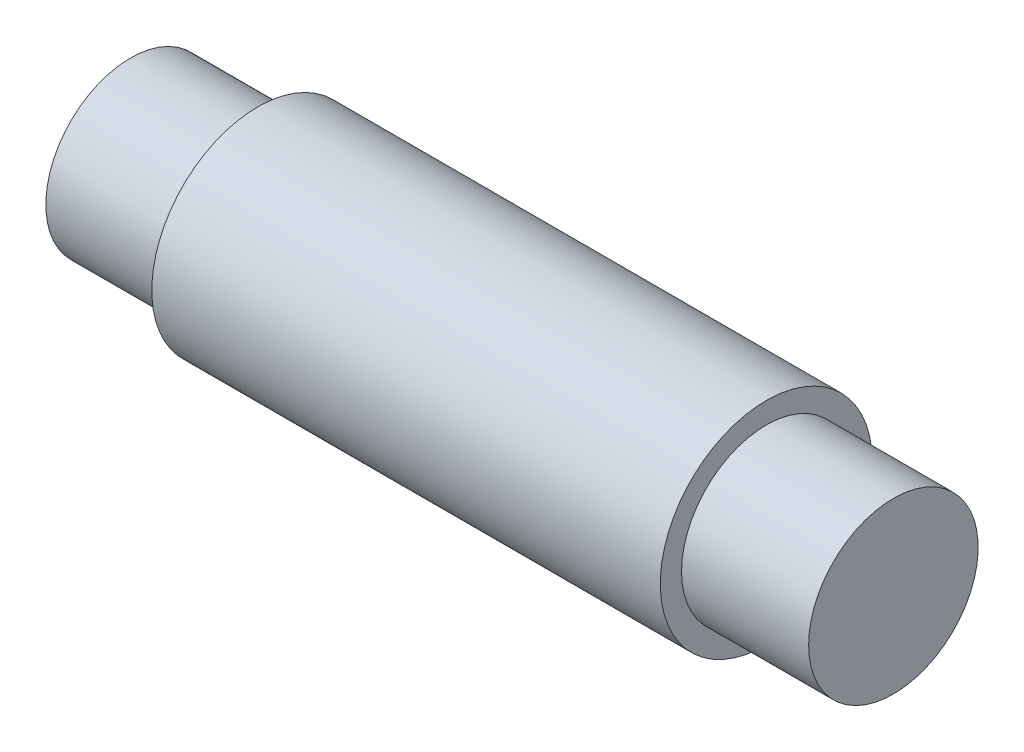
from build123d import *

# Parameters (mm, degrees)
SKETCH2_R           = 3.175
BOSS_EXTRUDE1_DEPTH = 2.38125
SKETCH3_R           = 3.96875
BOSS_EXTRUDE2_DEPTH = 19.05
SKETCH5_R           = 3.175
BOSS_EXTRUDE3_DEPTH = 4.7625


with BuildPart() as part:
    # Sketch2 → Boss-Extrude1 (new, symmetric)
    with BuildSketch(Plane(origin=(0, 0, 0), x_dir=(0, 0, -1), z_dir=(1, 0, 0))):
        with Locations(Location((0, 0, 0), (0, 0, 180))):
            Circle(SKETCH2_R)
    extrude(amount=BOSS_EXTRUDE1_DEPTH, both=True)

    # Sketch3 → Boss-Extrude2 (add)
    with BuildSketch(Plane.ZY.offset(2.38125)):
        with Locations(Location((0, 0, 0), (0, 0, 180))):
            Circle(SKETCH3_R)
    extrude(amount=BOSS_EXTRUDE2_DEPTH)

    # Sketch5 → Boss-Extrude3 (add)
    with BuildSketch(Plane.ZY.offset(21.43125)):
        Circle(SKETCH5_R)
    extrude(amount=BOSS_EXTRUDE3_DEPTH)


solid = part.part
